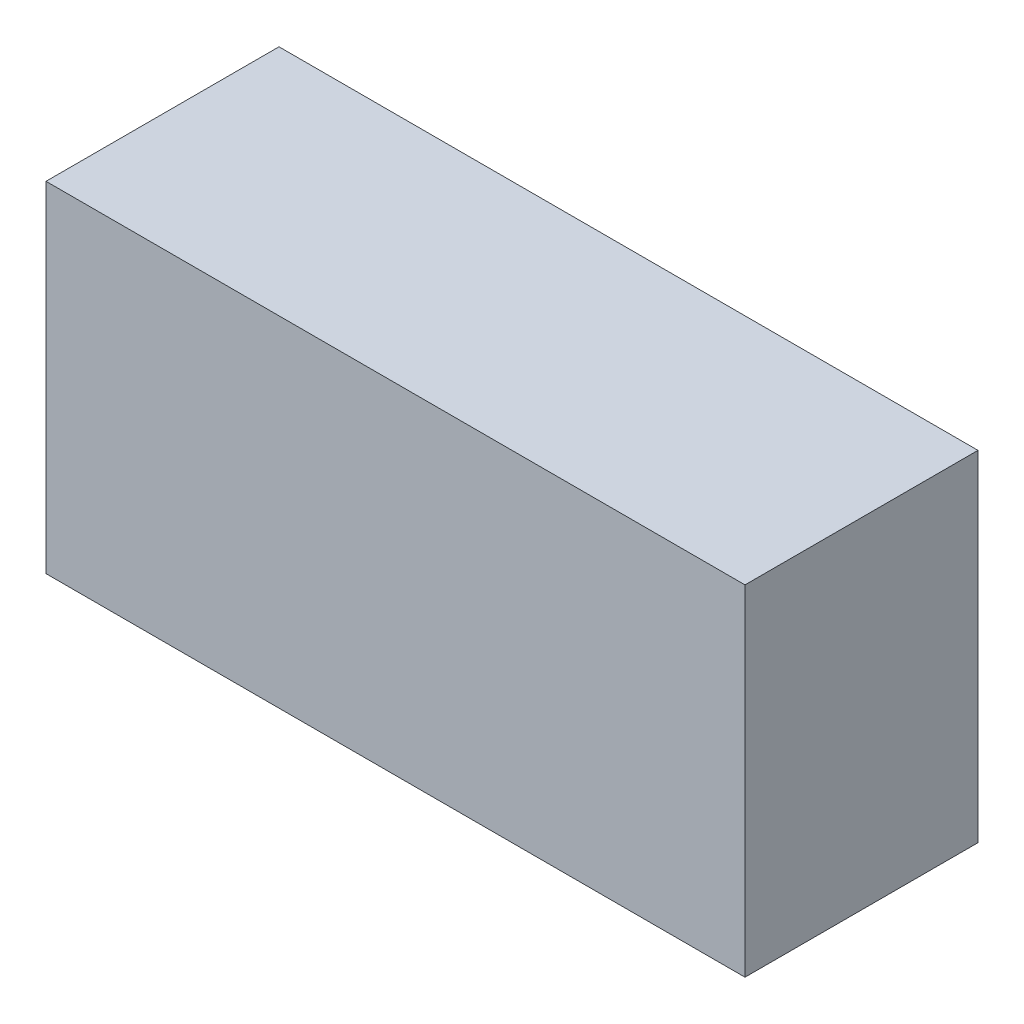
from build123d import *

# Parameters (mm, degrees)
SKETCH_1_W      = 108
SKETCH_1_H      = 36
EXTRUDE_1_DEPTH = 52.5


with BuildPart() as part:
    # 草图1 → 凸台-拉伸1 (new body)
    with BuildSketch(Plane(origin=(0, 0, 0), x_dir=(1, 0, 0), z_dir=(0, 1, 0))):
        with Locations((54, 18)):
            Rectangle(SKETCH_1_W, SKETCH_1_H)
    extrude(amount=EXTRUDE_1_DEPTH)


solid = part.part
